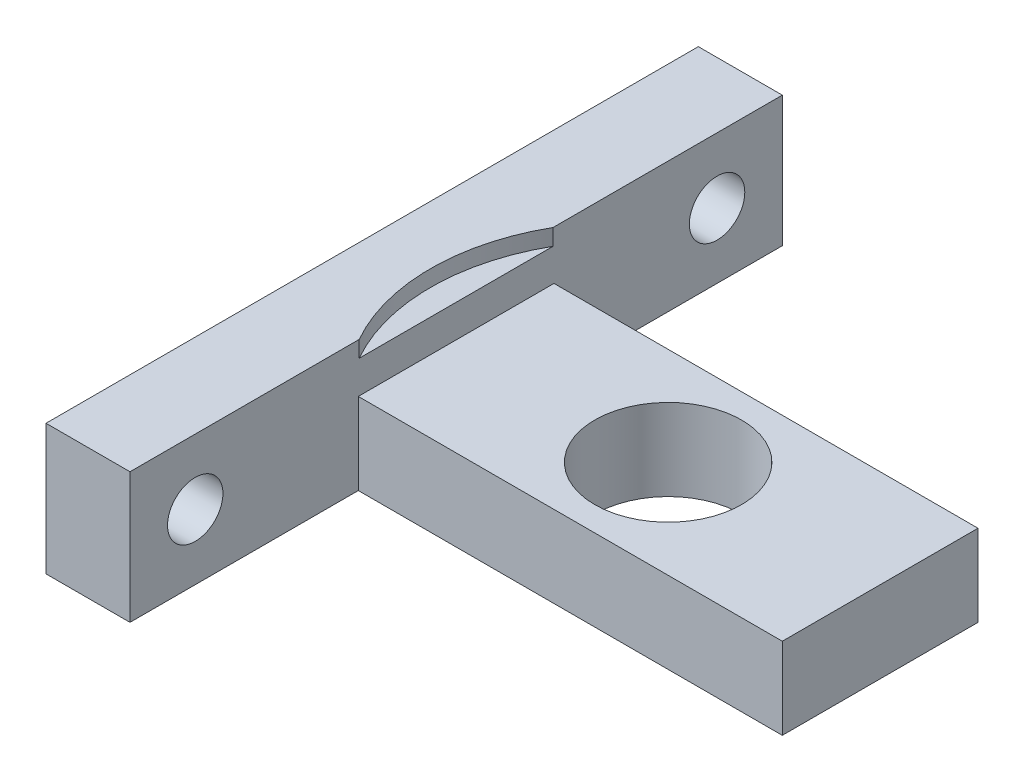
from build123d import *

# Parameters (mm, degrees)
CROQUIS1_W              = 5.15
CROQUIS1_H              = 40
SALIENTE_EXTRUIR1_DEPTH = 8
CROQUIS2_R              = 1.7
CORTAR_EXTRUIR1_DEPTH   = 11
CROQUIS3_W              = 26
CROQUIS3_H              = 12
CROQUIS3_R              = 4.5
SALIENTE_EXTRUIR2_DEPTH = 5
CROQUIS4_R              = 12
CORTAR_EXTRUIR2_DEPTH   = 1


with BuildPart() as part:
    # Croquis1 → Saliente-Extruir1 (new body)
    with BuildSketch(Plane(origin=(0, 0, 0), x_dir=(1, 0, 0), z_dir=(0, 1, 0))):
        Rectangle(CROQUIS1_W, CROQUIS1_H)
    extrude(amount=-SALIENTE_EXTRUIR1_DEPTH)

    # Croquis2 → Cortar-Extruir1 (cut)
    with BuildSketch(Plane(origin=(2.575, 0, 0), x_dir=(0, 0, -1), z_dir=(1, 0, 0))):
        with Locations((-16, -4)):
            Circle(CROQUIS2_R)
        with Locations((16, -4)):
            Circle(CROQUIS2_R)
    extrude(amount=-CORTAR_EXTRUIR1_DEPTH, mode=Mode.SUBTRACT)

    # Croquis3 → Saliente-Extruir2 (add)
    with BuildSketch(Plane(origin=(0, -8, 0), x_dir=(1, 0, 0), z_dir=(0, 1, 0))):
        with Locations((15.575, 0)):
            Rectangle(CROQUIS3_W, CROQUIS3_H)
        with Locations(Location((15.575, 0, 0), (0, 0, 270))):
            Circle(CROQUIS3_R, mode=Mode.SUBTRACT)
    extrude(amount=SALIENTE_EXTRUIR2_DEPTH)

    # Croquis4 → Cortar-Extruir2 (cut)
    with BuildSketch(Plane(origin=(0, 0, 0), x_dir=(1, 0, 0), z_dir=(0, 1, 0))):
        with Locations((13, 0)):
            Circle(CROQUIS4_R)
    extrude(amount=-CORTAR_EXTRUIR2_DEPTH, mode=Mode.SUBTRACT)


solid = part.part
